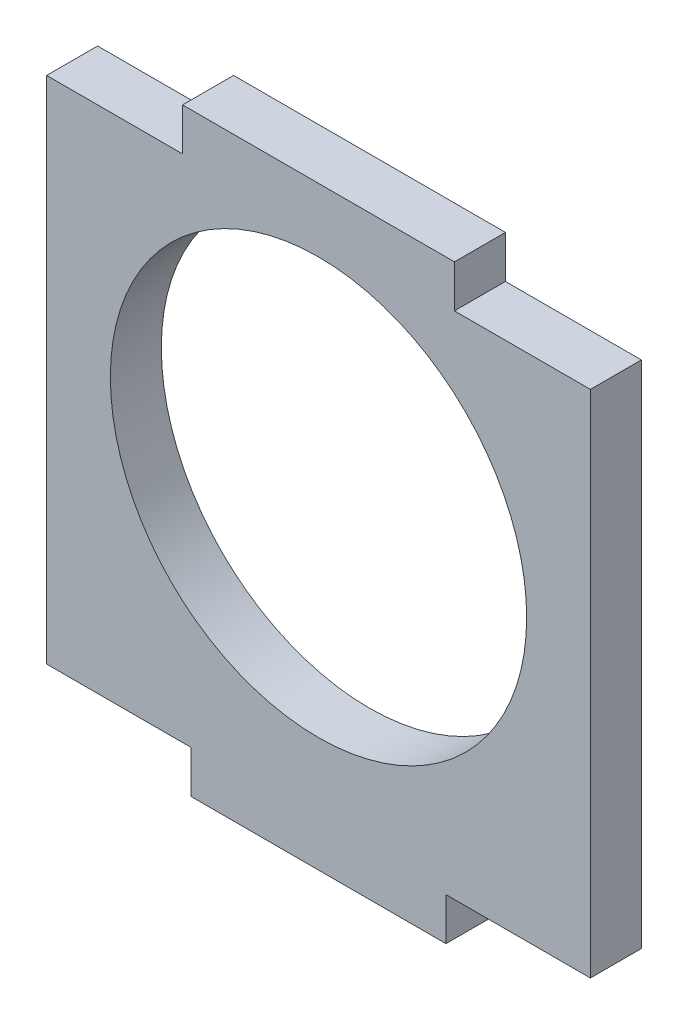
from build123d import *

# Parameters (mm, degrees)
ESQUISSE1_R        = 12.25
BOSS_EXTRU_1_DEPTH = 3


with BuildPart() as part:
    # Esquisse1 → Boss.-Extru.1 (new body)
    with BuildSketch(Plane.XY):
        Polygon((-16, 15), (-8, 15), (-8, 17.5), (8, 17.5), (8, 15), (16, 15), (16, -15), (7.5, -15), (7.5, -17.5), (-7.5, -17.5), (-7.5, -15), (-16, -15), align=None)
        with Locations((0, 1.5)):
            Circle(ESQUISSE1_R, mode=Mode.SUBTRACT)
    extrude(amount=BOSS_EXTRU_1_DEPTH)


solid = part.part
